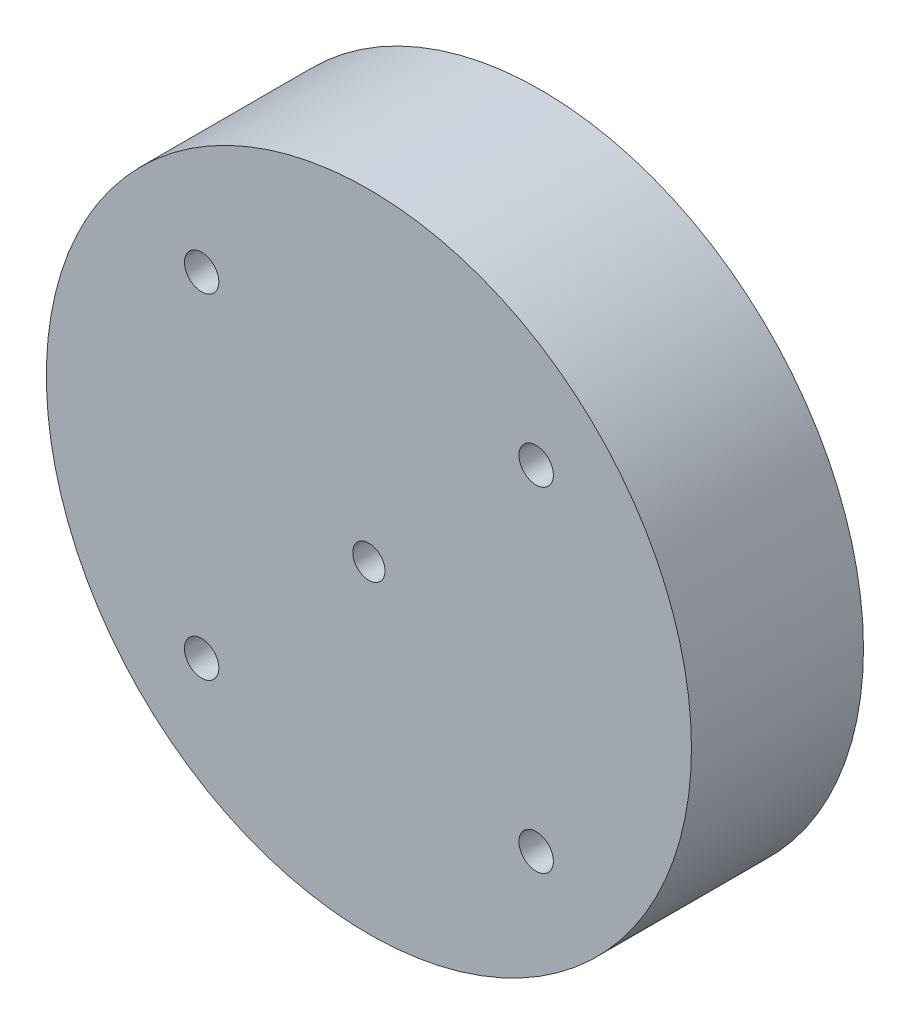
from build123d import *

# Parameters (mm, degrees)
SKETCH1_R           = 30
SKETCH1_R_2         = 1.5
BOSS_EXTRUDE1_DEPTH = 16
SKETCH2_R           = 1.6
CUT_EXTRUDE2_DEPTH  = 17


with BuildPart() as part:
    # Sketch1 → Boss-Extrude1 (new body)
    with BuildSketch(Plane.XY):
        Circle(SKETCH1_R)
        Circle(SKETCH1_R_2, mode=Mode.SUBTRACT)
    extrude(amount=BOSS_EXTRUDE1_DEPTH)

    # Sketch2 → Cut-Extrude2 (cut)
    with BuildSketch(Plane.XY):
        with Locations((15.556349186, 15.556349186)):
            Circle(SKETCH2_R)
        with Locations((-15.556349186, 15.556349186)):
            Circle(SKETCH2_R)
        with Locations((-15.556349186, -15.556349186)):
            Circle(SKETCH2_R)
        with Locations((15.556349186, -15.556349186)):
            Circle(SKETCH2_R)
    extrude(amount=CUT_EXTRUDE2_DEPTH, mode=Mode.SUBTRACT)


solid = part.part
